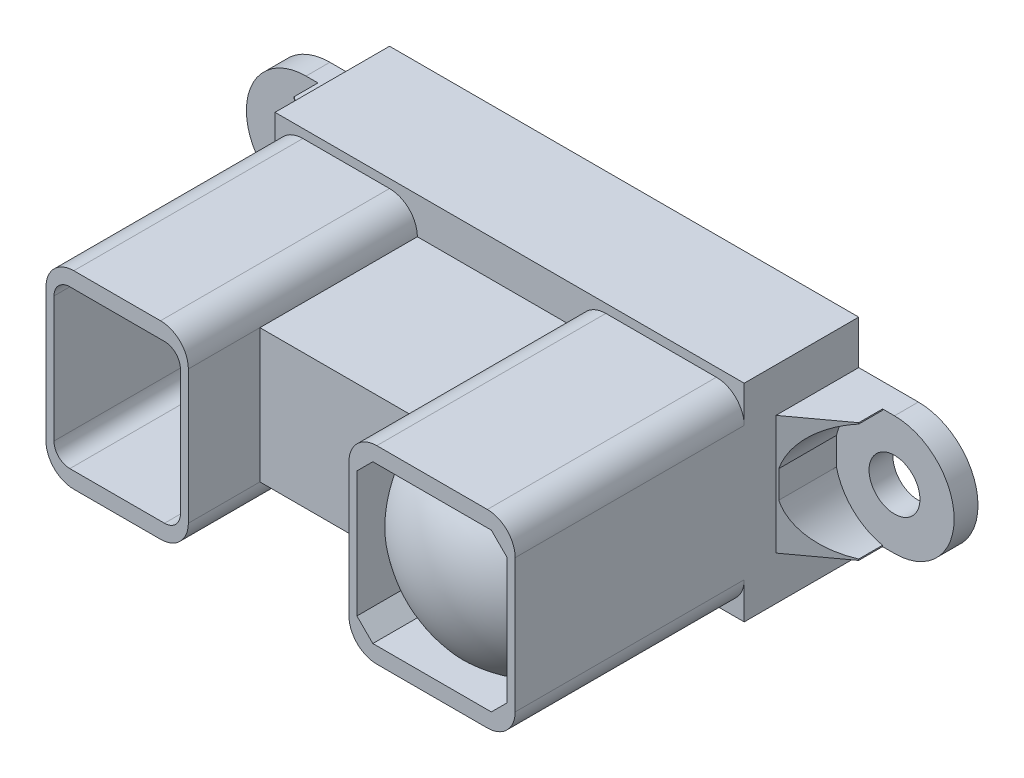
from build123d import *

# Parameters (mm, degrees)
SKETCH1_R                = 1.6
BOSS_EXTRUDE1_DEPTH      = 7.2
CUT_EXTRUDE1_DEPTH       = 46.901288027
CUT_EXTRUDE2_DEPTH       = 45.728108035
BOSS_EXTRUDE4_DEPTH      = 14.4
SKETCH6_W                = 10.1
SKETCH6_H                = 8.4
BOSS_EXTRUDE5_DEPTH      = 9.9
REVOLVE1_ANGLE           = 180
CUT_EXTRUDE3_DEPTH       = 4
SKETCH13_W               = 28.5
SKETCH13_H               = 12
CUT_EXTRUDE4_DEPTH       = 3.3
BOSS_EXTRUDE6_DEPTH      = 1.2
BOSS_EXTRUDE7_DEPTH      = 3.95
BOSS_EXTRUDE7_DEPTH_BACK = 3.95
SKETCH16_W               = 6.9
SKETCH16_H               = 3.8
CUT_EXTRUDE5_DEPTH       = 5.5
SKETCH18_R               = 0.5
BOSS_EXTRUDE8_DEPTH      = 5.25
FILLET1_R                = 0.5


with BuildPart() as part:
    # Sketch1 → Boss-Extrude1 (new body)
    with BuildSketch(Plane.XY):
        with BuildLine():
            Line((-39.67911745, 6.306787833), (-35.92911745, 6.306787833))
            Line((-35.92911745, 6.306787833), (-35.92911745, 9.056787833))
            Line((-35.92911745, 9.056787833), (-6.42911745, 9.056787833))
            Line((-6.42911745, 9.056787833), (-6.42911745, 6.306787833))
            Line((-6.42911745, 6.306787833), (-2.67911745, 6.306787833))
            ThreePointArc((-2.67911745, 6.306787833), (1.07088255, 2.556787833), (-2.67911745, -1.193212167))
            Line((-2.67911745, -1.193212167), (-6.42911745, -1.193212167))
            Line((-6.42911745, -1.193212167), (-6.42911745, -3.943212167))
            Line((-6.42911745, -3.943212167), (-16.12911745, -3.943212167))
            Line((-16.12911745, -3.943212167), (-16.12911745, -3.079352829))
            ThreePointArc((-16.12911745, -3.079352829), (-16.680326656, -2.453304755), (-16.87911745, -1.643212167))
            Line((-16.87911745, -1.643212167), (-25.47911745, -1.643212167))
            ThreePointArc((-25.47911745, -1.643212167), (-25.677908244, -2.453304755), (-26.22911745, -3.079352829))
            Line((-26.22911745, -3.079352829), (-26.22911745, -3.943212167))
            Line((-26.22911745, -3.943212167), (-35.92911745, -3.943212167))
            Line((-35.92911745, -3.943212167), (-35.92911745, -1.193212167))
            Line((-35.92911745, -1.193212167), (-39.67911745, -1.193212167))
            ThreePointArc((-39.67911745, -1.193212167), (-43.42911745, 2.556787833), (-39.67911745, 6.306787833))
        make_face()
        with Locations((-39.67911745, 2.556787833)):
            Circle(SKETCH1_R, mode=Mode.SUBTRACT)
        with Locations((-2.67911745, 2.556787833)):
            Circle(SKETCH1_R, mode=Mode.SUBTRACT)
    extrude(amount=BOSS_EXTRUDE1_DEPTH)

    # Sketch3 → Cut-Extrude1 (cut, through all)
    with BuildSketch(Plane.XZ.offset(3.943212167)):
        Polygon((-44.543539252, 1.5), (-38.92911745, 1.5), (-38.92911745, 3), (-35.92911745, 5.2), (-35.92911745, 8.378943839), (-44.543539252, 8.378943839), align=None)
        Polygon((2.185304351, 8.378943839), (2.185304351, 1.5), (-3.42911745, 1.5), (-3.42911745, 3), (-6.42911745, 5.2), (-6.42911745, 8.378943839), align=None)
    extrude(amount=-CUT_EXTRUDE1_DEPTH, mode=Mode.SUBTRACT)

    # Sketch4 → Cut-Extrude2 (cut, through all)
    with BuildSketch(Plane.XY.offset(1.5)):
        with BuildLine():
            Line((-36.02911745, 3.417020359), (-36.02911745, 1.696555306))
            ThreePointArc((-36.02911745, 1.696555306), (-43.42911745, 2.556787833), (-36.02911745, 3.417020359))
        make_face()
        with BuildLine():
            Line((-6.32911745, 3.417020359), (-6.32911745, 1.696555306))
            ThreePointArc((-6.32911745, 1.696555306), (1.07088255, 2.556787833), (-6.32911745, 3.417020359))
        make_face()
    extrude(amount=CUT_EXTRUDE2_DEPTH, mode=Mode.SUBTRACT)

    # Sketch5 → Boss-Extrude4 (add)
    # profile 1 of 2: a face of its own
    with BuildSketch(Plane.XY.offset(7.2)):
        with BuildLine():
            Line((-34.17911745, 8.506787833), (-28.72911745, 8.506787833))
            ThreePointArc((-28.72911745, 8.506787833), (-27.491680583, 7.9942247), (-26.97911745, 6.756787833))
            Line((-26.97911745, 6.756787833), (-26.97911745, -1.643212167))
            ThreePointArc((-26.97911745, -1.643212167), (-27.491680583, -2.880649034), (-28.72911745, -3.393212167))
            Line((-28.72911745, -3.393212167), (-34.17911745, -3.393212167))
            ThreePointArc((-34.17911745, -3.393212167), (-35.416554317, -2.880649034), (-35.92911745, -1.643212167))
            Line((-35.92911745, -1.643212167), (-35.92911745, 6.756787833))
            ThreePointArc((-35.92911745, 6.756787833), (-35.416554317, 7.9942247), (-34.17911745, 8.506787833))
        make_face()
        with BuildLine():
            Line((-34.42911745, 7.506787833), (-28.47911745, 7.506787833))
            ThreePointArc((-28.47911745, 7.506787833), (-27.772010669, 7.213894614), (-27.47911745, 6.506787833))
            Line((-27.47911745, 6.506787833), (-27.47911745, -1.393212167))
            ThreePointArc((-27.47911745, -1.393212167), (-27.772010669, -2.100318948), (-28.47911745, -2.393212167))
            Line((-28.47911745, -2.393212167), (-34.42911745, -2.393212167))
            ThreePointArc((-34.42911745, -2.393212167), (-35.136224231, -2.100318948), (-35.42911745, -1.393212167))
            Line((-35.42911745, -1.393212167), (-35.42911745, 6.506787833))
            ThreePointArc((-35.42911745, 6.506787833), (-35.136224231, 7.213894614), (-34.42911745, 7.506787833))
        make_face(mode=Mode.SUBTRACT)
    # profile 2 of 2: a face of its own
    with BuildSketch(Plane.XY.offset(7.2)):
        with BuildLine():
            Line((-15.12911745, 8.506787833), (-8.17911745, 8.506787833))
            ThreePointArc((-8.17911745, 8.506787833), (-6.941680583, 7.9942247), (-6.42911745, 6.756787833))
            Line((-6.42911745, 6.756787833), (-6.42911745, -1.643212167))
            ThreePointArc((-6.42911745, -1.643212167), (-6.941680583, -2.880649034), (-8.17911745, -3.393212167))
            Line((-8.17911745, -3.393212167), (-15.12911745, -3.393212167))
            ThreePointArc((-15.12911745, -3.393212167), (-16.366554317, -2.880649034), (-16.87911745, -1.643212167))
            Line((-16.87911745, -1.643212167), (-16.87911745, 6.756787833))
            ThreePointArc((-16.87911745, 6.756787833), (-16.366554317, 7.9942247), (-15.12911745, 8.506787833))
        make_face()
        Polygon((-15.37911745, 7.506787833), (-7.92911745, 7.506787833), (-6.92911745, 6.506787833), (-6.92911745, -1.393212167), (-7.92911745, -2.393212167), (-15.37911745, -2.393212167), (-16.37911745, -1.393212167), (-16.37911745, 6.506787833), align=None, mode=Mode.SUBTRACT)
    extrude(amount=BOSS_EXTRUDE4_DEPTH)

    # Sketch6 → Boss-Extrude5 (add)
    with BuildSketch(Plane.XY.offset(7.2)):
        with Locations((-21.92911745, 2.556787833)):
            Rectangle(SKETCH6_W, SKETCH6_H)
    extrude(amount=BOSS_EXTRUDE5_DEPTH)

    # Sketch7 → Revolve1 (revolve)
    with BuildSketch(Plane.XY.offset(7.2)):
        with BuildLine():
            Line((-31.45411745, 6.527394978), (-31.45411745, -1.272605022))
            ThreePointArc((-31.45411745, -1.272605022), (-27.55411745, 2.627394978), (-31.45411745, 6.527394978))
        make_face()
    revolve(axis=Axis((-31.45411745, 8.506787833, 7.2), (0, -1, 0)), revolution_arc=REVOLVE1_ANGLE)

    # Sketch11 → Revolve7 (revolve)
    with BuildSketch(Plane(origin=(-11.65411745, 0, 0), x_dir=(0, 0, -1), z_dir=(1, 0, 0))):
        with BuildLine():
            Line((-17.85, 9.006787833), (-17.85, 2.556787833))
            Line((-17.85, 2.556787833), (-21.522794753, 2.556787833))
            ThreePointArc((-21.522794753, 2.556787833), (-20.54023441, 6.267984449), (-17.85, 9.006787833))
        make_face()
    revolve(axis=Axis((-11.65411745, 2.556787833, 6.48), (0, 0, 1)))

    # Sketch12 → Cut-Extrude3 (cut)
    with BuildSketch(Plane.XY.offset(21.6)):
        with BuildLine():
            Line((-9.164137531, 8.506787833), (-14.14409737, 8.506787833))
            ThreePointArc((-14.14409737, 8.506787833), (-11.65411745, 9.006787833), (-9.164137531, 8.506787833))
        make_face()
        with BuildLine():
            Line((-6.42911745, -1.224994155), (-6.42911745, 6.33856982))
            ThreePointArc((-6.42911745, 6.33856982), (-5.20411745, 2.556787833), (-6.42911745, -1.224994155))
        make_face()
        with BuildLine():
            Line((-14.14409737, -3.393212167), (-9.164137531, -3.393212167))
            ThreePointArc((-9.164137531, -3.393212167), (-11.65411745, -3.893212167), (-14.14409737, -3.393212167))
        make_face()
        with BuildLine():
            Line((-16.87911745, 6.33856982), (-16.87911745, -1.224994155))
            ThreePointArc((-16.87911745, -1.224994155), (-18.10411745, 2.556787833), (-16.87911745, 6.33856982))
        make_face()
    extrude(amount=-CUT_EXTRUDE3_DEPTH, mode=Mode.SUBTRACT)

    # Sketch13 → Cut-Extrude4 (cut)
    with BuildSketch(Plane(origin=(0, 0, 0), x_dir=(-1, 0, 0), z_dir=(0, 0, -1))):
        with Locations((21.17911745, 2.556787833)):
            Rectangle(SKETCH13_W, SKETCH13_H)
    extrude(amount=-CUT_EXTRUDE4_DEPTH, mode=Mode.SUBTRACT)

    # Sketch14 → Boss-Extrude6 (add)
    with BuildSketch(Plane(origin=(0, 0, 3.3), x_dir=(-1, 0, 0), z_dir=(0, 0, -1))):
        with BuildLine():
            Line((26.22911745, -3.943212167), (26.22911745, -3.079352829))
            ThreePointArc((26.22911745, -3.079352829), (25.677908244, -2.453304755), (25.47911745, -1.643212167))
            Line((25.47911745, -1.643212167), (16.87911745, -1.643212167))
            ThreePointArc((16.87911745, -1.643212167), (16.680326656, -2.453304755), (16.12911745, -3.079352829))
            Line((16.12911745, -3.079352829), (16.12911745, -3.943212167))
            Line((16.12911745, -3.943212167), (16.12911745, -8.843212167))
            ThreePointArc((16.12911745, -8.843212167), (16.422010669, -9.550318948), (17.12911745, -9.843212167))
            Line((17.12911745, -9.843212167), (25.22911745, -9.843212167))
            ThreePointArc((25.22911745, -9.843212167), (25.936224231, -9.550318948), (26.22911745, -8.843212167))
            Line((26.22911745, -8.843212167), (26.22911745, -3.943212167))
        make_face()
    extrude(amount=-BOSS_EXTRUDE6_DEPTH)

    # Sketch15 → Boss-Extrude7 (add, two sides: drawn at the far end of the back side and taken through both)
    with BuildSketch(Plane.ZY.offset(21.17911745).offset(-BOSS_EXTRUDE7_DEPTH_BACK)):
        with BuildLine():
            Line((6.5, -2.143212167), (4.5, -2.143212167))
            Line((4.5, -2.143212167), (4.5, -9.743212167))
            Line((4.5, -9.743212167), (7.1, -9.743212167))
            Line((7.1, -9.743212167), (7.1, -8.243212167))
            ThreePointArc((7.1, -8.243212167), (7.6, -7.743212167), (8.1, -8.243212167))
            Line((8.1, -8.243212167), (8.1, -9.743212167))
            Line((8.1, -9.743212167), (9.3, -9.743212167))
            Line((9.3, -9.743212167), (9.3, -3.743212167))
            Line((9.3, -3.743212167), (8.1, -3.743212167))
            Line((8.1, -3.743212167), (6.5, -2.143212167))
        make_face()
    extrude(amount=BOSS_EXTRUDE7_DEPTH + BOSS_EXTRUDE7_DEPTH_BACK)

    # Sketch16 → Cut-Extrude5 (cut)
    with BuildSketch(Plane.XZ.offset(9.743212167)):
        with Locations((-21.17911745, 6.9)):
            Rectangle(SKETCH16_W, SKETCH16_H)
    extrude(amount=-CUT_EXTRUDE5_DEPTH, mode=Mode.SUBTRACT)

    # Sketch18 → Boss-Extrude8 (add)
    with BuildSketch(Plane.XZ.offset(4.243212167)):
        with Locations(Location((-21.17911745, 6.9, 0), (0, 0, 270))):
            Circle(SKETCH18_R)
        with Locations(Location((-19.17911745, 6.9, 0), (0, 0, 270))):
            Circle(SKETCH18_R)
        with Locations(Location((-23.17911745, 6.9, 0), (0, 0, 270))):
            Circle(SKETCH18_R)
    extrude(amount=BOSS_EXTRUDE8_DEPTH)

    # Fillet1
    fillet1_edges = [part.edges().sort_by_distance(p)[0] for p in [
        (-21.17911745, -9.493212167, 7.4),
        (-19.17911745, -9.493212167, 7.4),
        (-23.17911745, -9.493212167, 7.4),
    ]]
    fillet(fillet1_edges, radius=FILLET1_R)


solid = part.part
